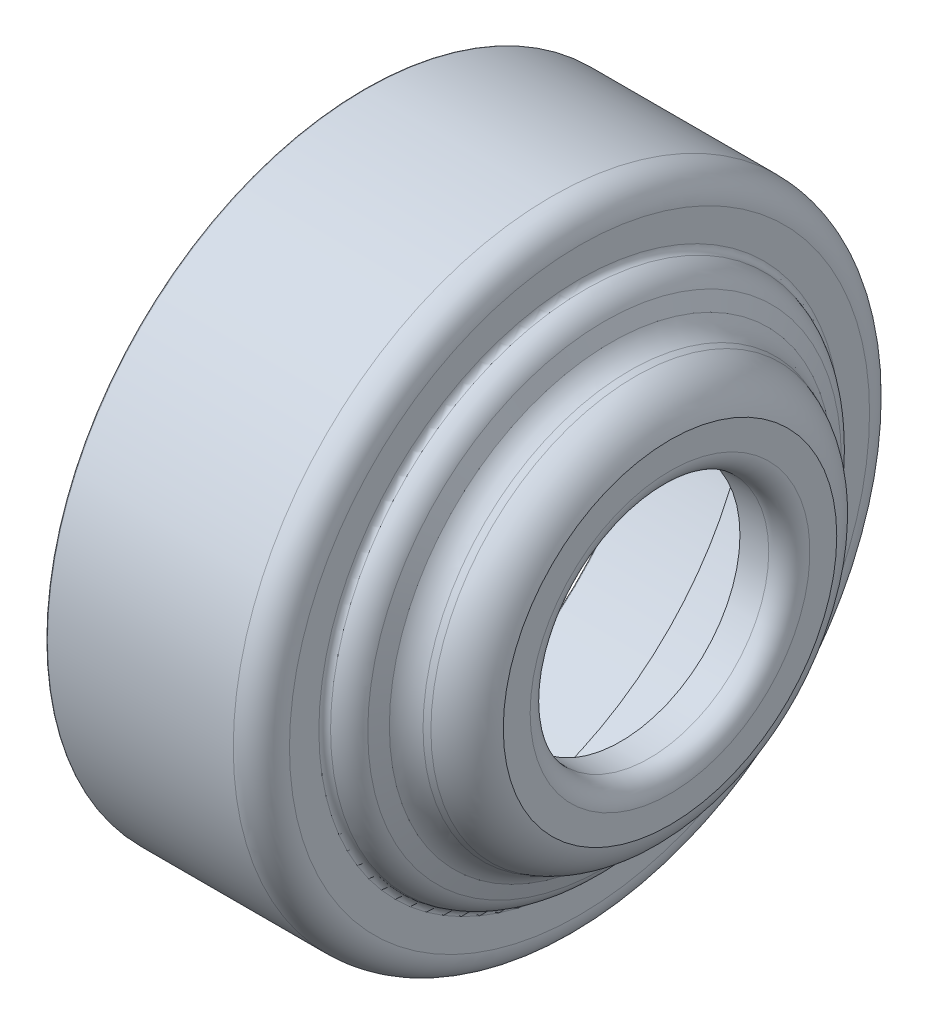
from build123d import *

# Parameters (mm, degrees)
FILLET_2_R = 0.1


with BuildPart() as part:
    # 草图1 → 旋转1 (revolve)
    with BuildSketch(Plane.XY, mode=Mode.PRIVATE) as revolve_1_sk:
        with BuildLine():
            Line((-14.9, 22), (-7.9, 22))
            Line((-7.9, 22), (-7.9, 21.4))
            Line((-7.9, 21.4), (-0.9, 21.4))
            ThreePointArc((-0.9, 21.4), (-0.546446609, 21.253553391), (-0.4, 20.9))
            Line((-0.4, 20.9), (-0.4, 17.7))
            ThreePointArc((-0.4, 17.7), (-0.312132034, 17.487867966), (-0.1, 17.4))
            Line((-0.1, 17.4), (0.6, 17.4))
            ThreePointArc((0.6, 17.4), (1.151191515, 17.235686238), (1.520698216, 16.794918843))
            Line((1.520698216, 16.794918843), (2.021934946, 15.614079106))
            ThreePointArc((2.021934946, 15.614079106), (2.877506402, 14.598878084), (4.024261235, 13.929857167))
            Line((4.024261235, 13.929857167), (4.466083411, 13.765100692))
            ThreePointArc((4.466083411, 13.765100692), (5.551233185, 13.096887028), (6.2, 12))
            Line((6.2, 12), (6.2, 9.9))
            ThreePointArc((6.2, 9.9), (6.053553391, 9.546446609), (5.7, 9.4))
            Line((5.7, 9.4), (3.8, 9.4))
            Line((3.8, 9.4), (3.8, 8.7))
            Line((3.8, 8.7), (5.9, 8.7))
            ThreePointArc((5.9, 8.7), (6.960660172, 9.139339828), (7.4, 10.2))
            Line((7.4, 10.2), (7.4, 12.159619657))
            ThreePointArc((7.4, 12.159619657), (6.484407577, 13.857005044), (4.861211336, 14.898475447))
            Line((4.861211336, 14.898475447), (4.44354078, 15.054225729))
            ThreePointArc((4.44354078, 15.054225729), (3.676756338, 15.494955061), (3.093809388, 16.160066764))
            Line((3.093809388, 16.160066764), (2.624444612, 17.265820884))
            ThreePointArc((2.624444612, 17.265820884), (2.042509235, 18.062794628), (1.170737289, 18.525211763))
            ThreePointArc((1.170737289, 18.525211763), (0.903369596, 18.703772991), (0.8, 19.00821399))
            Line((0.8, 19.00821399), (0.8, 21.15))
            ThreePointArc((0.8, 21.15), (0.199568901, 22.599568901), (-1.25, 23.2))
            Line((-1.25, 23.2), (-14.9, 23.2))
            Line((-14.9, 23.2), (-14.9, 22))
        make_face()
    revolve(revolve_1_sk.sketch.rotate(Axis((-28.972485425, 0, 0), (1, 0, 0)), 90), axis=Axis((-28.972485425, 0, 0), (1, 0, 0)))

    # 圆角2
    fillet_2_edges = [part.edges().sort_by_distance(p)[0] for p in [
        (-14.9, 0, -23.2),
        (-14.9, 0, -22),
    ]]
    fillet(fillet_2_edges, radius=FILLET_2_R)


solid = part.part
